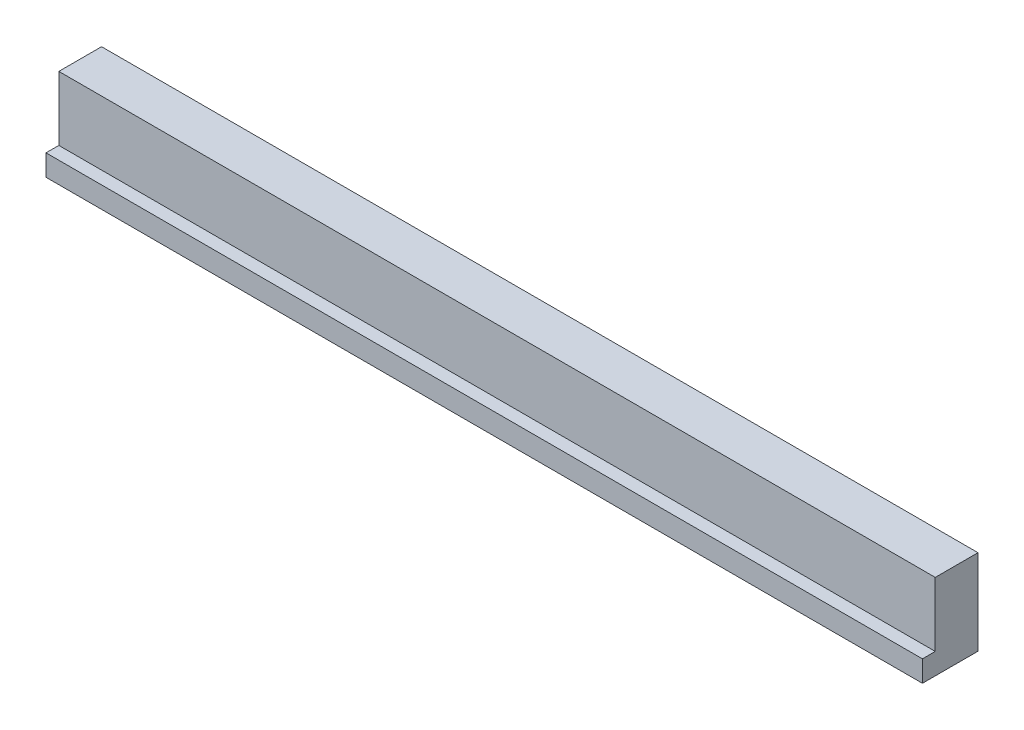
from build123d import *

# Parameters (mm, degrees)
BOSS_EXTRUDE1_DEPTH = 260.35


with BuildPart() as part:
    # Sketch2 → Boss-Extrude1 (new body)
    with BuildSketch(Plane(origin=(0, 0, 0), x_dir=(0, 0, -1), z_dir=(1, 0, 0))):
        Polygon((0, 0), (16.51, 0), (16.51, 25.3492), (3.81, 25.3492), (3.81, 6.2992), (0, 6.2992), align=None)
    extrude(amount=-BOSS_EXTRUDE1_DEPTH)


solid = part.part
